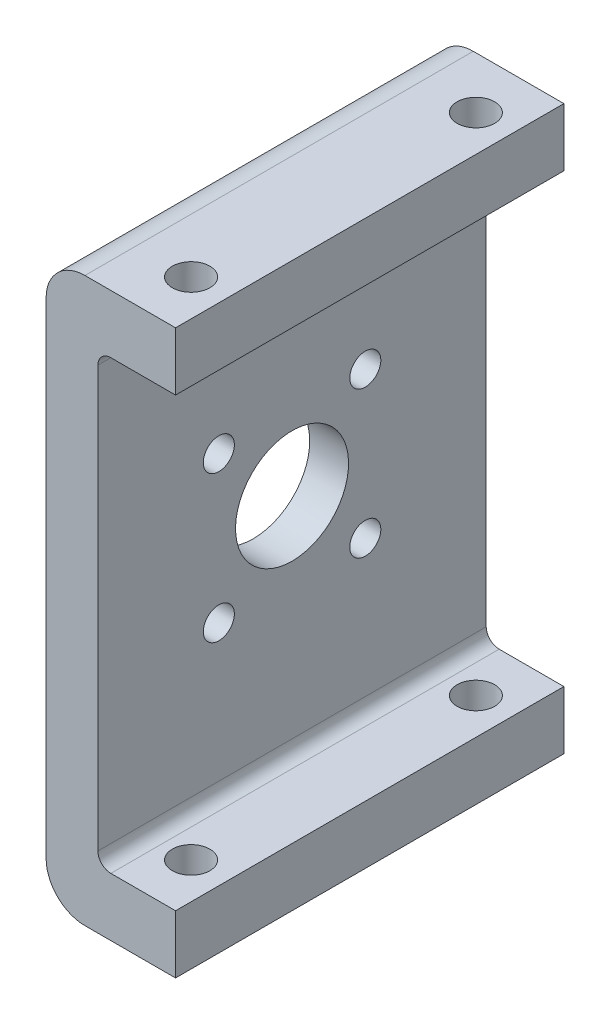
from build123d import *

# Parameters (mm, degrees)
BOSS_EXTRUDE1_DEPTH     = 15
M2_5_CLEARANCE_HOLE1_D  = 2.9
CUT_EXTRUDE1_DEPTH      = 28.093587802
CUT_EXTRUDE1_DEPTH_BACK = 28.093587802
SKETCH3_R               = 4.365625
M2_CLEARANCE_HOLE1_D    = 2.4
SKETCH10_R              = 11.5
CUT_EXTRUDE3_DEPTH      = 1
FILLET1_R               = 1
FILLET2_R               = 3


with BuildPart() as part:
    # Sketch2 → Boss-Extrude1 (new, symmetric)
    with BuildSketch(Plane.XY):
        Polygon((0, 21.75), (0, -21.75), (10, -21.75), (10, -17.25), (4, -17.25), (4, 17.25), (10, 17.25), (10, 21.75), align=None)
    extrude(amount=BOSS_EXTRUDE1_DEPTH, both=True)

    # M2.5 Clearance Hole1 (through all)
    with Locations(Plane(origin=(0, -21.75, 0), x_dir=(-1, 0, 0), z_dir=(0, -1, 0))):
        with Locations((-7.2, -11), (-7.2, 11)):
            Hole(M2_5_CLEARANCE_HOLE1_D / 2)

    # Sketch3 → Cut-Extrude1 (cut, two sides: drawn at the far end of the back side and taken through both)
    with BuildSketch(Plane(origin=(4, 0, 0), x_dir=(0, 0, -1), z_dir=(1, 0, 0)).offset(-CUT_EXTRUDE1_DEPTH_BACK)):
        with Locations(Location((0, 0, 0), (0, 0, 90))):
            Circle(SKETCH3_R)
    extrude(amount=CUT_EXTRUDE1_DEPTH + CUT_EXTRUDE1_DEPTH_BACK, mode=Mode.SUBTRACT)

    # M2 Clearance Hole1 (through all)
    with Locations(Plane.ZY):
        with Locations((5.656854249, 5.656854249), (5.656854249, -5.656854249), (-5.656854249, -5.656854249), (-5.656854249, 5.656854249), (0, 0)):
            Hole(M2_CLEARANCE_HOLE1_D / 2)

    # Sketch10 → Cut-Extrude3 (cut)
    with BuildSketch(Plane.ZY):
        with Locations(Location((0, 0, 0), (0, 0, 270))):
            Circle(SKETCH10_R)
    extrude(amount=-CUT_EXTRUDE3_DEPTH, mode=Mode.SUBTRACT)

    # Fillet1
    fillet1_edges = [part.edges().sort_by_distance(p)[0] for p in [
        (4, 17.25, 0),
        (4, -17.25, 0),
    ]]
    fillet(fillet1_edges, radius=FILLET1_R)

    # Fillet2
    fillet2_edges = [part.edges().sort_by_distance(p)[0] for p in [
        (0, -21.75, 0),
        (0, 21.75, 0),
    ]]
    fillet(fillet2_edges, radius=FILLET2_R)


solid = part.part
